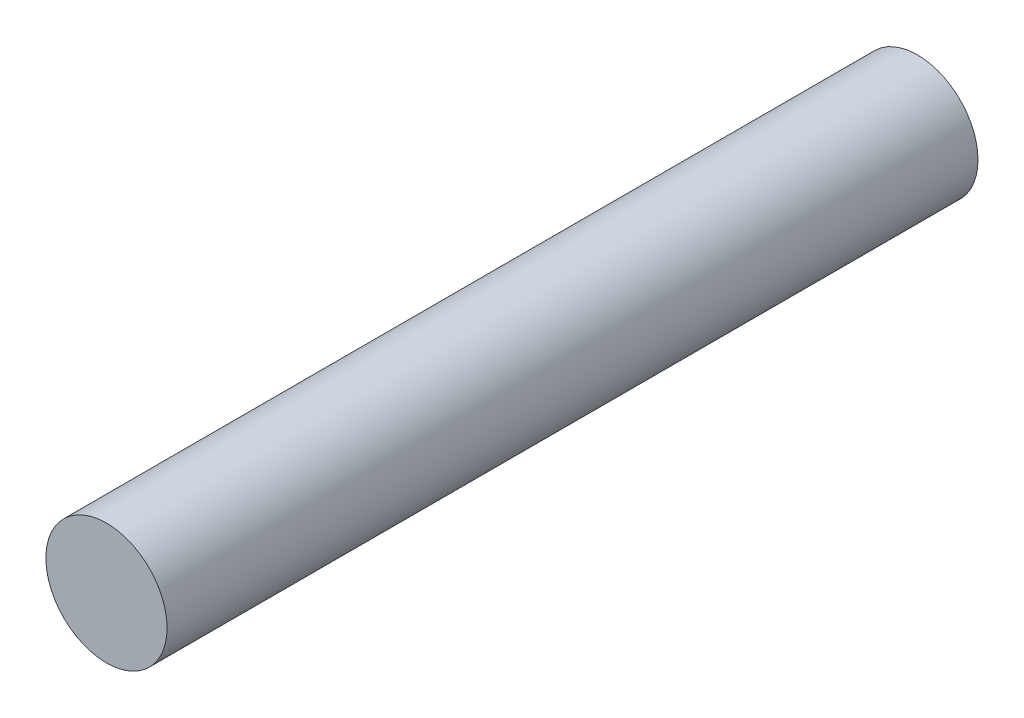
from build123d import *

# Parameters (mm, degrees)
SKETCH1_R           = 25.4
BOSS_EXTRUDE1_DEPTH = 339.852


with BuildPart() as part:
    # Sketch1 → Boss-Extrude1 (new body)
    with BuildSketch(Plane.XY):
        Circle(SKETCH1_R)
    extrude(amount=BOSS_EXTRUDE1_DEPTH)


solid = part.part
